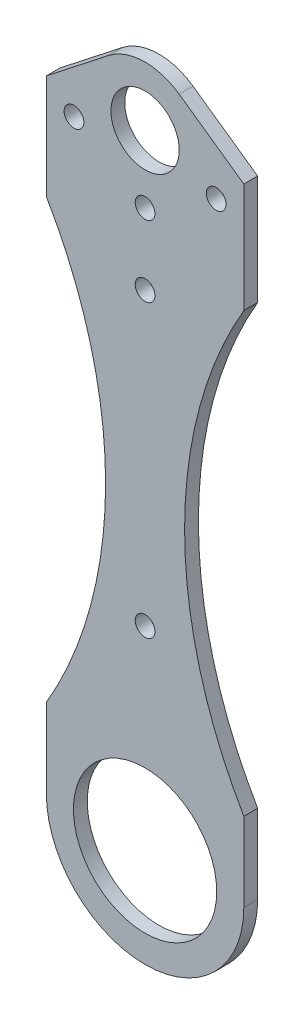
from build123d import *

# Parameters (mm, degrees)
SKETCH2_R           = 23.0378
SKETCH2_R_2         = 3.175
SKETCH2_R_3         = 10.9855
BOSS_EXTRUDE1_DEPTH = 4.445
SKETCH4_R           = 3.175
CUT_EXTRUDE2_DEPTH  = 149.225118982
CUT_EXTRUDE3_DEPTH  = 149.225118982


with BuildPart() as part:
    # Sketch2 → Boss-Extrude1 (new body)
    with BuildSketch(Plane.XY):
        with BuildLine():
            Line((31.75, 112.9665), (-31.75, 112.9665))
            Line((-31.75, 112.9665), (-31.75, 53.2765))
            ThreePointArc((-31.75, 53.2765), (-12.7, -17.145), (-31.75, -87.5665))
            Line((-31.75, -87.5665), (-31.75, -112.9665))
            ThreePointArc((-31.75, -112.9665), (0, -144.7165), (31.75, -112.9665))
            Line((31.75, -112.9665), (31.75, -87.5665))
            ThreePointArc((31.75, -87.5665), (12.7, -17.145), (31.75, 53.2765))
            Line((31.75, 53.2765), (31.75, 112.9665))
        make_face()
        with Locations((0, -112.9665)):
            Circle(SKETCH2_R, mode=Mode.SUBTRACT)
        with Locations((-22.86, 79.9465)):
            Circle(SKETCH2_R_2, mode=Mode.SUBTRACT)
        with Locations((0, 65.9765)):
            Circle(SKETCH2_R_2, mode=Mode.SUBTRACT)
        with Locations((0, 87.5665)):
            Circle(SKETCH2_R_3, mode=Mode.SUBTRACT)
        with Locations((22.86, 79.9465)):
            Circle(SKETCH2_R_2, mode=Mode.SUBTRACT)
    extrude(amount=BOSS_EXTRUDE1_DEPTH)

    # Sketch4 → Cut-Extrude2 (cut, through all)
    with BuildSketch(Plane.XY.offset(4.445)):
        with Locations((0, 43.1165)):
            Circle(SKETCH4_R)
        with Locations((0, -50.419)):
            Circle(SKETCH4_R)
    extrude(amount=-CUT_EXTRUDE2_DEPTH, mode=Mode.SUBTRACT)

    # Sketch6 → Cut-Extrude3 (cut, through all)
    with BuildSketch(Plane(origin=(0, 0, 0), x_dir=(-1, 0, 0), z_dir=(0, 0, -1))):
        with BuildLine():
            Line((-31.75, 112.9665), (-31.75, 88.521600063))
            Line((-31.75, 88.521600063), (-10.961308866, 103.147007307))
            ThreePointArc((-10.961308866, 103.147007307), (0.491450562, 106.610159741), (11.750340751, 102.560898695))
            Line((11.750340751, 102.560898695), (31.75, 86.888192115))
            Line((31.75, 86.888192115), (31.75, 112.9665))
            Line((31.75, 112.9665), (-31.75, 112.9665))
        make_face()
    extrude(amount=-CUT_EXTRUDE3_DEPTH, mode=Mode.SUBTRACT)


solid = part.part
